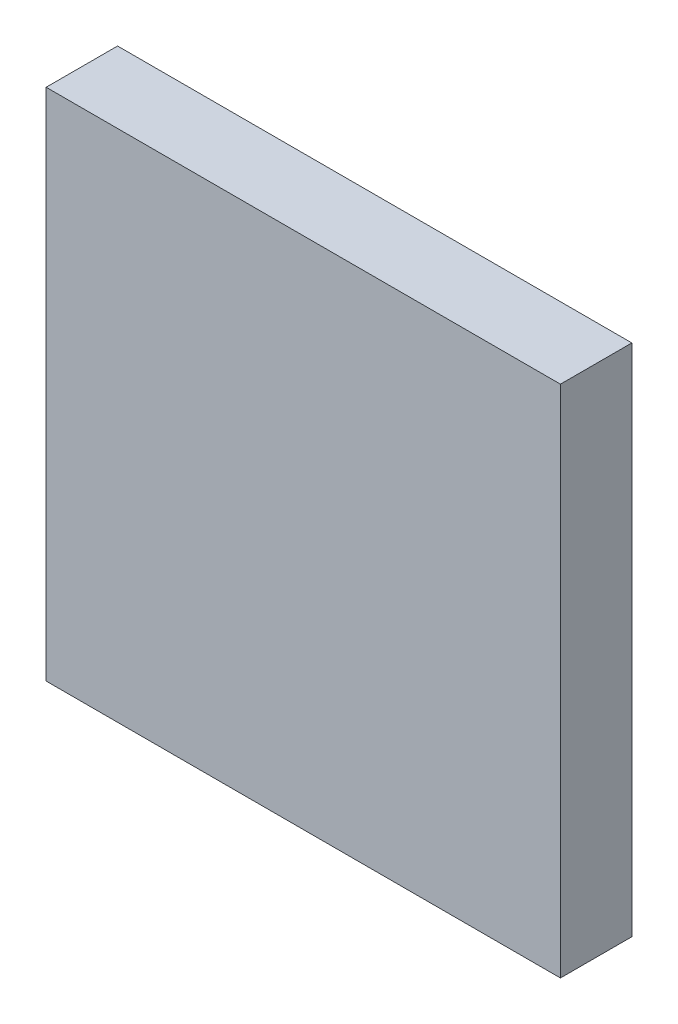
from build123d import *

# Parameters (mm, degrees)
SKETCH_1_W      = 36
SKETCH_1_H      = 36
SKETCH_1_R      = 2
EXTRUDE_1_DEPTH = 3
SKETCH_2_W      = 36
SKETCH_2_H      = 36
EXTRUDE_2_DEPTH = 2


with BuildPart() as part:
    # 스케치1 → 보스-돌출1 (new body)
    with BuildSketch(Plane.XY):
        with Locations((17.845923561, -15.757575758)):
            Rectangle(SKETCH_1_W, SKETCH_1_H)
        with Locations((2.595923561, -0.507575758)):
            Circle(SKETCH_1_R, mode=Mode.SUBTRACT)
        with Locations((17.845923561, -0.507575758)):
            Circle(SKETCH_1_R, mode=Mode.SUBTRACT)
        with Locations((33.095923561, -0.507575758)):
            Circle(SKETCH_1_R, mode=Mode.SUBTRACT)
        with Locations((33.095923561, -15.757575758)):
            Circle(SKETCH_1_R, mode=Mode.SUBTRACT)
        with Locations((33.095923561, -31.007575758)):
            Circle(SKETCH_1_R, mode=Mode.SUBTRACT)
        with Locations((17.845923561, -31.007575758)):
            Circle(SKETCH_1_R, mode=Mode.SUBTRACT)
        with Locations((2.595923561, -31.007575758)):
            Circle(SKETCH_1_R, mode=Mode.SUBTRACT)
        with Locations((2.595923561, -15.757575758)):
            Circle(SKETCH_1_R, mode=Mode.SUBTRACT)
    extrude(amount=EXTRUDE_1_DEPTH)

    # 스케치2 → 보스-돌출2 (add)
    with BuildSketch(Plane.XY.offset(3)):
        with Locations((17.845923561, -15.757575758)):
            Rectangle(SKETCH_2_W, SKETCH_2_H)
    extrude(amount=EXTRUDE_2_DEPTH)


solid = part.part
